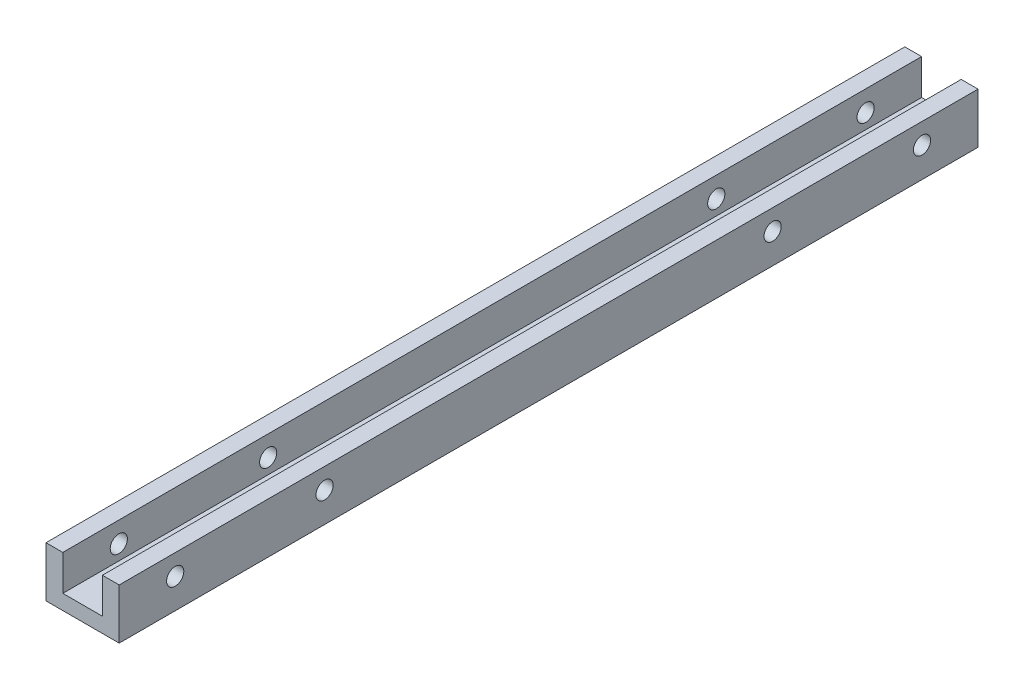
from build123d import *

# Parameters (mm, degrees)
EXTRUDE_1_DEPTH     = 230
SKETCH_2_R          = 2.3
CUT_EXTRUDE_1_DEPTH = 230


with BuildPart() as part:
    # Эскиз1 → Бобышка-Вытянуть1 (new body)
    with BuildSketch(Plane.XY):
        Polygon((0, 0), (0, 9.5), (-4.5, 9.5), (-4.5, -4), (15.1, -4), (15.1, 9.5), (10.6, 9.5), (10.6, 0), align=None)
    extrude(amount=EXTRUDE_1_DEPTH)

    # Эскиз2 → Вырез-Вытянуть1 (cut)
    with BuildSketch(Plane(origin=(15.1, 0, 0), x_dir=(0, 0, -1), z_dir=(1, 0, 0))):
        with Locations(Location((-215, 4, 0), (0, 0, 90))):
            Circle(SKETCH_2_R)
        with Locations(Location((-175, 4, 0), (0, 0, 90))):
            Circle(SKETCH_2_R)
        with Locations(Location((-55, 4, 0), (0, 0, 90))):
            Circle(SKETCH_2_R)
        with Locations(Location((-15, 4, 0), (0, 0, 90))):
            Circle(SKETCH_2_R)
    extrude(amount=-CUT_EXTRUDE_1_DEPTH, mode=Mode.SUBTRACT)


solid = part.part
